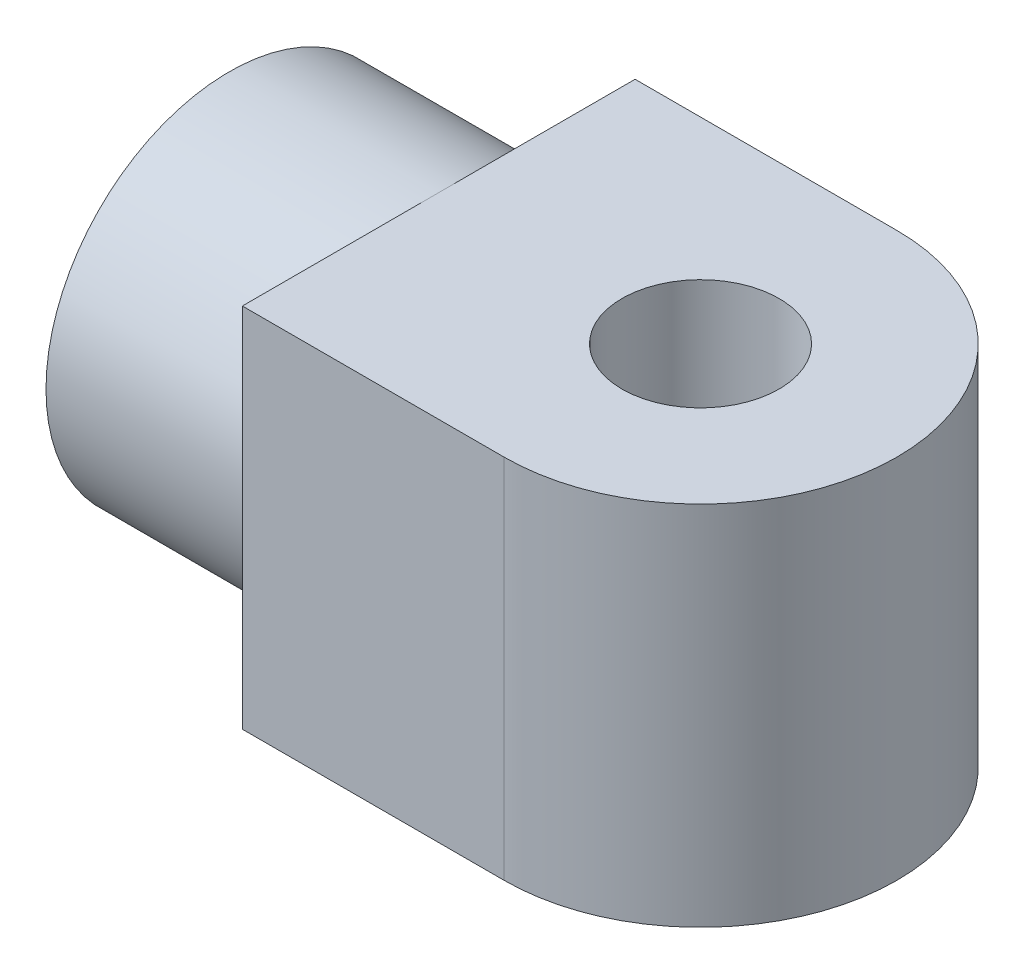
from build123d import *

# Parameters (mm, degrees)
SKETCH_1_R          = 3
EXTRUDE_1_DEPTH     = 14
SKETCH_2_R          = 7
SKETCH_2_R_2        = 4
EXTRUDE_2_DEPTH     = 8
CUT_EXTRUDE_START   = -4
SKETCH_2_2_R        = 4
CUT_EXTRUDE_1_DEPTH = 4


with BuildPart() as part:
    # 草图1 → 凸台-拉伸1 (new body)
    with BuildSketch(Plane(origin=(0, 0, 0), x_dir=(1, 0, 0), z_dir=(0, 1, 0))):
        with BuildLine():
            Line((-5, 7.5), (5, 7.5))
            ThreePointArc((5, 7.5), (12.5, 0), (5, -7.5))
            Line((5, -7.5), (-5, -7.5))
            Line((-5, -7.5), (-5, 7.5))
        make_face()
        with Locations((5, 0)):
            Circle(SKETCH_1_R, mode=Mode.SUBTRACT)
    extrude(amount=EXTRUDE_1_DEPTH)

    # 草图2 → 凸台-拉伸2 (add)
    with BuildSketch(Plane.ZY.offset(5)):
        with Locations((0, 7)):
            Circle(SKETCH_2_R)
        with Locations((0, 7)):
            Circle(SKETCH_2_R_2, mode=Mode.SUBTRACT)
    extrude(amount=EXTRUDE_2_DEPTH)

    # 草图2<2> → 切除-拉伸1 (cut)
    with BuildSketch(Plane.ZY.offset(5).offset(CUT_EXTRUDE_START)):
        with Locations((0, 7)):
            Circle(SKETCH_2_2_R)
    extrude(amount=CUT_EXTRUDE_1_DEPTH, mode=Mode.SUBTRACT)


solid = part.part
